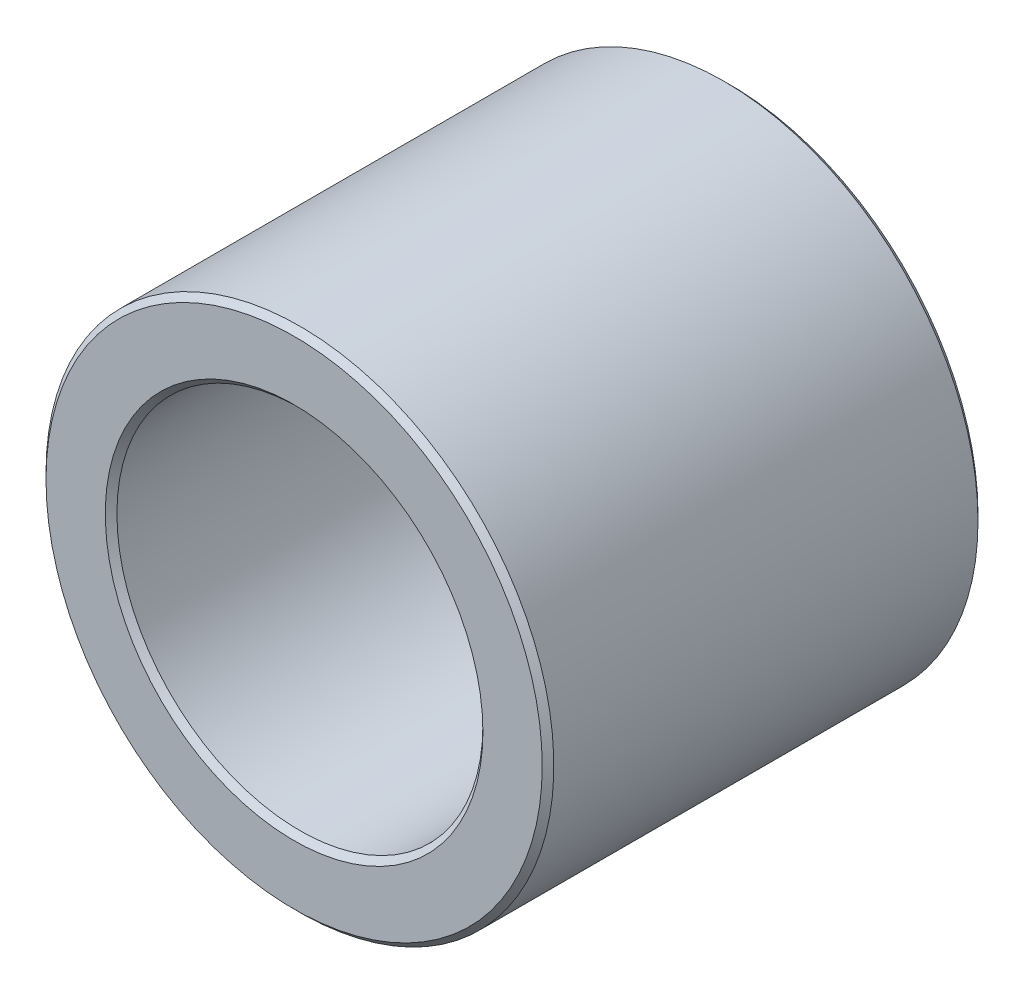
from build123d import *

# Parameters (mm, degrees)
SKETCH1_R           = 5.5499
SKETCH1_R_2         = 4.000000001
BOSS_EXTRUDE1_DEPTH = 9.525
CHAMFER1_SIZE       = 0.127


with BuildPart() as part:
    # Sketch1 → Boss-Extrude1 (new body)
    with BuildSketch(Plane.XY):
        with Locations(Location((0, 0, 0), (0, 0, 180))):
            Circle(SKETCH1_R)
        with Locations(Location((0, 0, 0), (0, 0, 180))):
            Circle(SKETCH1_R_2, mode=Mode.SUBTRACT)
    extrude(amount=BOSS_EXTRUDE1_DEPTH)

    # Chamfer1
    chamfer1_edges = [part.edges().sort_by_distance(p)[0] for p in [
        (5.5499, 0, 0),
        (5.5499, 0, 9.525),
        (4.000000001, 0, 0),
        (4.000000001, 0, 9.525),
    ]]
    chamfer(chamfer1_edges, length=CHAMFER1_SIZE)


solid = part.part
